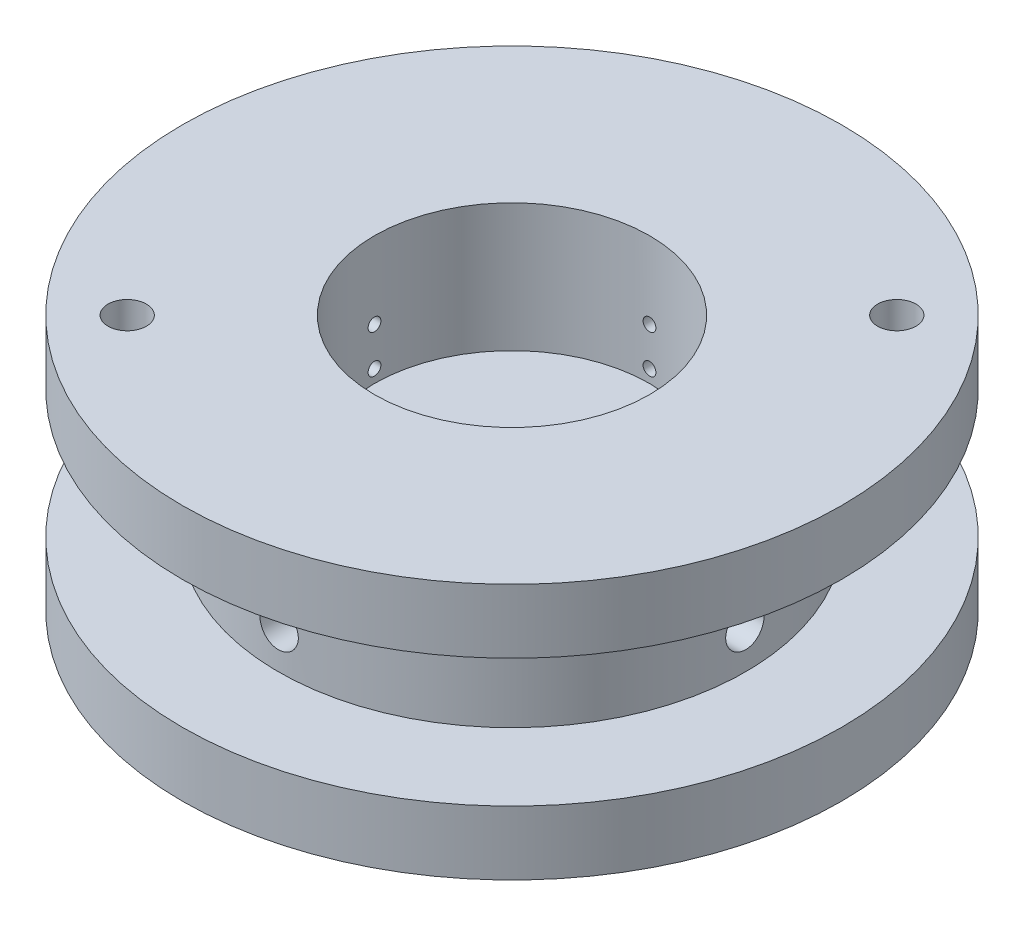
from build123d import *

# Parameters (mm, degrees)
SKETCH3_R          = 0.5
SKETCH3_R_2        = 1.5
CUT_EXTRUDE1_DEPTH = 43.545563811
CIRPATTERN1_COUNT  = 2
CIRPATTERN1_ANGLE  = 90
SKETCH4_R          = 1.5
CUT_EXTRUDE2_DEPTH = 13


with BuildPart() as part:
    # Sketch2 → Revolve1 (revolve)
    with BuildSketch(Plane.XY, mode=Mode.PRIVATE) as revolve1_sk:
        Polygon((3.25, 0), (10.75, 0), (10.75, 2), (25.75, 2), (25.75, 7), (18.25, 7), (18.25, 17), (25.75, 17), (25.75, 22), (10.75, 22), (10.75, 12), (3.25, 12), align=None)
    revolve(revolve1_sk.sketch.rotate(Axis((0, 87.545500491, 0), (0, -1, 0)), 180), axis=Axis((0, 87.545500491, 0), (0, -1, 0)))

    # Sketch3 → Cut-Extrude1 (cut, symmetric)
    with BuildSketch(Plane(origin=(0, 0, 0), x_dir=(0, 0, -1), z_dir=(1, 0, 0))):
        with Locations((0, 13)):
            Circle(SKETCH3_R)
        with Locations((0, 16)):
            Circle(SKETCH3_R)
        with Locations((0, 10)):
            Circle(SKETCH3_R_2)
    cut_extrude1 = extrude(amount=CUT_EXTRUDE1_DEPTH, both=True, mode=Mode.SUBTRACT)

    # CirPattern1: Cut-Extrude1 ×2 about axis
    cirpattern1_axis = Axis((0, 22, 0), (0, 1, 0))
    for i in range(1, CIRPATTERN1_COUNT):
        add(cut_extrude1.rotate(cirpattern1_axis, i * CIRPATTERN1_ANGLE / (CIRPATTERN1_COUNT - 1)), mode=Mode.SUBTRACT)

    # Sketch4 → Cut-Extrude2 (cut)
    with BuildSketch(Plane(origin=(0, 22, 0), x_dir=(1, 0, 0), z_dir=(0, 1, 0))):
        with Locations(Location((15.0260191, 15.0260191, 0), (0, 0, 180))):
            Circle(SKETCH4_R)
        with Locations(Location((-15.0260191, -15.0260191, 0), (0, 0, 180))):
            Circle(SKETCH4_R)
    extrude(amount=-CUT_EXTRUDE2_DEPTH, mode=Mode.SUBTRACT)


solid = part.part
